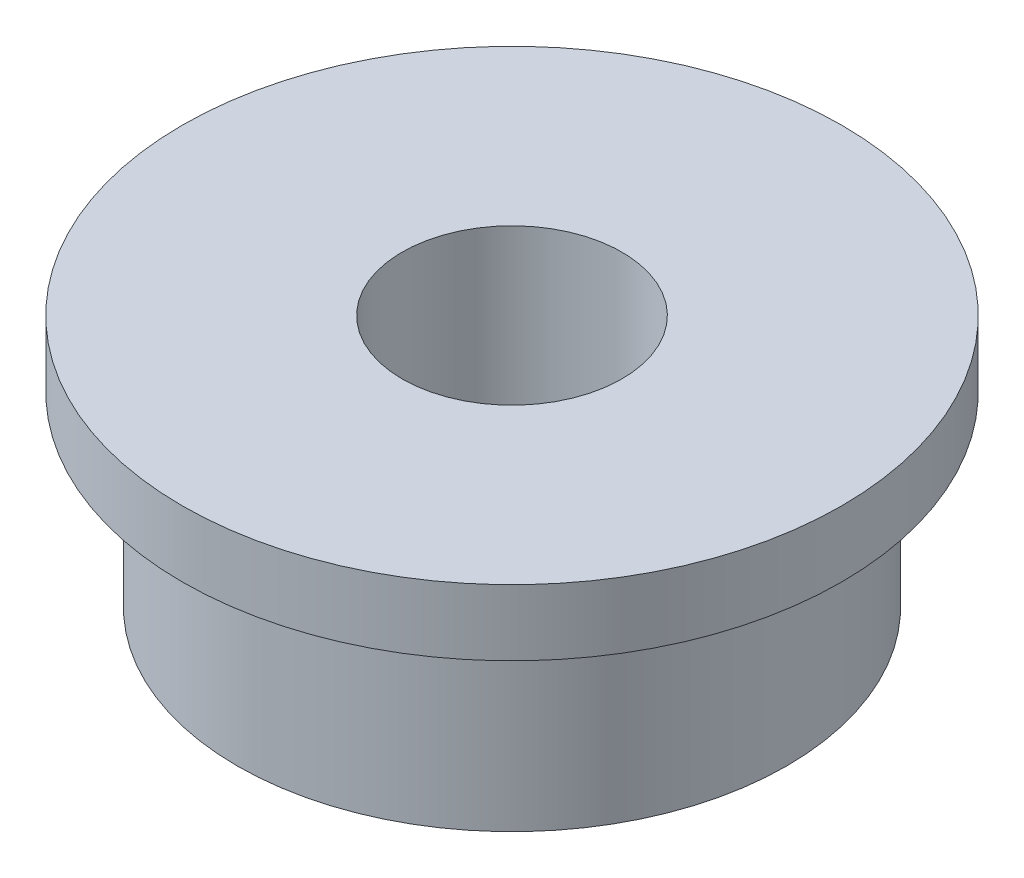
from build123d import *

# Parameters (mm, degrees)
SKETCH_1_R      = 2.5
SKETCH_1_R_2    = 1
EXTRUDE_1_DEPTH = 2.3
EXTRUDE_START   = -0.6
SKETCH_2_R      = 3
SKETCH_2_R_2    = 1
EXTRUDE_2_DEPTH = 0.6


with BuildPart() as part:
    # 草图1 → 凸台-拉伸1 (new body)
    with BuildSketch(Plane(origin=(0, 0, 0), x_dir=(1, 0, 0), z_dir=(0, 1, 0))):
        with Locations(Location((0, 0, 0), (0, 0, 270))):
            Circle(SKETCH_1_R)
        with Locations(Location((0, 0, 0), (0, 0, 270))):
            Circle(SKETCH_1_R_2, mode=Mode.SUBTRACT)
    extrude(amount=EXTRUDE_1_DEPTH)

    # 草图2 → 凸台-拉伸2 (add)
    with BuildSketch(Plane(origin=(0, 2.3, 0), x_dir=(1, 0, 0), z_dir=(0, 1, 0)).offset(EXTRUDE_START)):
        with Locations(Location((0, 0, 0), (0, 0, 270))):
            Circle(SKETCH_2_R)
        with Locations(Location((0, 0, 0), (0, 0, 270))):
            Circle(SKETCH_2_R_2, mode=Mode.SUBTRACT)
    extrude(amount=EXTRUDE_2_DEPTH)


solid = part.part
